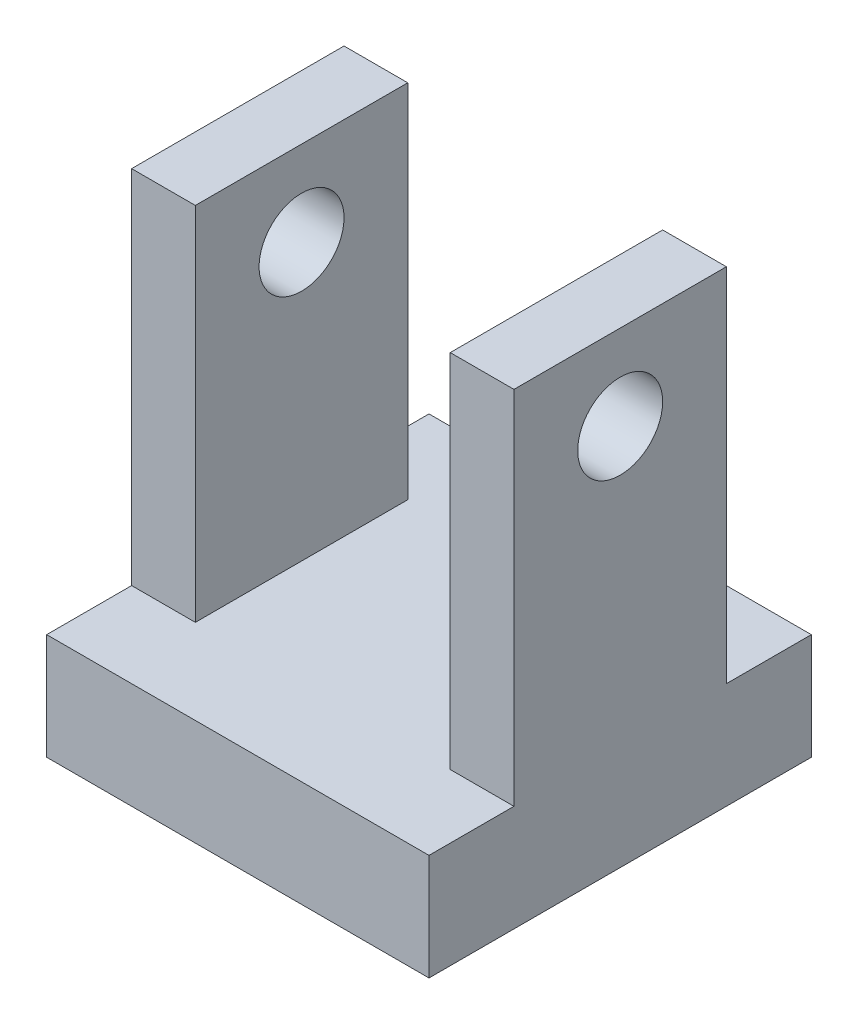
from build123d import *

# Parameters (mm, degrees)
SALIENTE_EXTRUIR2_DEPTH = 45
CORTAR_EXTRUIR3_DEPTH   = 90
CROQUIS5_R              = 10
CORTAR_EXTRUIR4_DEPTH   = 90


with BuildPart() as part:
    # Croquis1 → Saliente-Extruir2 (new, symmetric)
    with BuildSketch(Plane(origin=(0, 0, 0), x_dir=(0, 0, -1), z_dir=(1, 0, 0))):
        Polygon((45, 0), (-45, 0), (-45, 25), (-25, 25), (-25, 110), (25, 110), (25, 25), (45, 25), align=None)
    extrude(amount=SALIENTE_EXTRUIR2_DEPTH, both=True)

    # Croquis4 → Cortar-Extruir3 (cut)
    with BuildSketch(Plane.XY.offset(25)):
        Polygon((0, 110), (-30, 110), (-30, 25), (30, 25), (30, 110), align=None)
    extrude(amount=-CORTAR_EXTRUIR3_DEPTH, mode=Mode.SUBTRACT)

    # Croquis5 → Cortar-Extruir4 (cut)
    with BuildSketch(Plane(origin=(45, 0, 0), x_dir=(0, 0, -1), z_dir=(1, 0, 0))):
        with Locations((0, 90)):
            Circle(CROQUIS5_R)
    extrude(amount=-CORTAR_EXTRUIR4_DEPTH, mode=Mode.SUBTRACT)


solid = part.part
